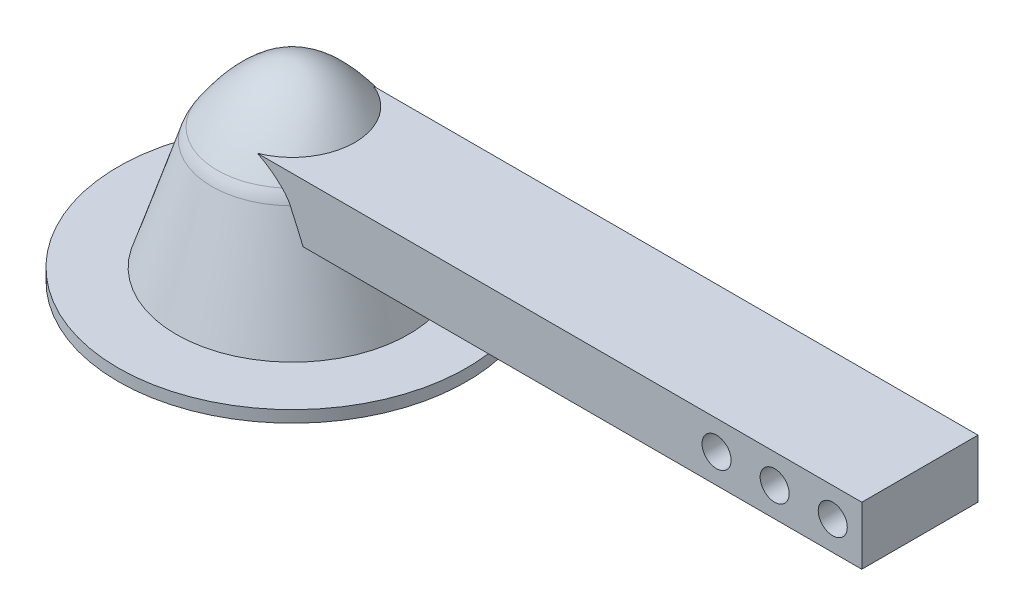
from build123d import *

# Parameters (mm, degrees)
SKETCH1_W                = 25.4
SKETCH1_H                = 6.35
FILLET1_R                = 10.16
BOSS_EXTRUDE1_DEPTH      = 38.1
BOSS_EXTRUDE1_DEPTH_BACK = 20.32
SKETCH3_W                = 25.4
SKETCH3_H                = 12.7
SKETCH4_W                = 25.4
SKETCH4_H                = 12.7
BOSS_EXTRUDE2_DEPTH      = 76.2
SKETCH5_R                = 3.175
CUT_EXTRUDE1_DEPTH       = 159.762008669


with BuildPart() as part:
    # Sketch1 → Revolve1 (revolve)
    with BuildSketch(Plane.XY, mode=Mode.PRIVATE) as revolve1_sk:
        Polygon((0, 48.048104246), (0, 22.664551268), (25.4, 22.664551268), (17.22966458, 48.048104246), align=None)
        Polygon((0, 22.664551268), (0, 20.09296726), (25.4, 20.09296726), (38.1, 20.09296726), (38.1, 22.664551268), (25.4, 22.664551268), align=None)
        with Locations((12.7, 16.91796726)):
            Rectangle(SKETCH1_W, SKETCH1_H)
    revolve(revolve1_sk.sketch.rotate(Axis((0, 27.702147105, 0), (0, -1, 0)), 90), axis=Axis((0, 27.702147105, 0), (0, -1, 0)))

    # Sketch2 → Revolve2 (revolve)
    with BuildSketch(Plane(origin=(0, 0, 0), x_dir=(0, 0, -1), z_dir=(1, 0, 0))):
        with BuildLine():
            Line((0, 48.048104246), (17.22966458, 48.048104246))
            add(Edge.make_bspline(
                [(17.22966458, 48.048104246), (8.61483229, 61.740341407), (0, 61.740341407)],
                knots=[0, 0, 0, 0.5, 0.5, 0.5], degree=2))
            Line((0, 61.740341407), (0, 48.048104246))
        make_face()
    revolve(axis=Axis((0, 0, 0), (0, 1, 0)))

    # Fillet1
    fillet1_edges = [part.edges().sort_by_distance(p)[0] for p in [
        (-17.22966458, 48.048104246, 0),
    ]]
    fillet(fillet1_edges, radius=FILLET1_R)

    # Sketch3 → Boss-Extrude1 (add, two sides: drawn at the far end of the back side and taken through both)
    with BuildSketch(Plane(origin=(22.86, 0, 0), x_dir=(0, 0, -1), z_dir=(1, 0, 0)).offset(-BOSS_EXTRUDE1_DEPTH_BACK)):
        with Locations((0, 46.783028789)):
            Rectangle(SKETCH3_W, SKETCH3_H)
    extrude(amount=BOSS_EXTRUDE1_DEPTH + BOSS_EXTRUDE1_DEPTH_BACK)

    # Sketch4 → Boss-Extrude2 (add)
    with BuildSketch(Plane(origin=(60.96, 0, 0), x_dir=(0, 0, -1), z_dir=(1, 0, 0))):
        with Locations((0, 46.783028789)):
            Rectangle(SKETCH4_W, SKETCH4_H)
    extrude(amount=BOSS_EXTRUDE2_DEPTH)

    # Sketch5 → Cut-Extrude1 (cut, through all)
    with BuildSketch(Plane(origin=(0, 0, -12.7), x_dir=(-1, 0, 0), z_dir=(0, 0, -1))):
        with Locations((-130.81, 46.783028789)):
            Circle(SKETCH5_R)
        with Locations((-118.11, 46.783028789)):
            Circle(SKETCH5_R)
        with Locations((-105.41, 46.783028789)):
            Circle(SKETCH5_R)
    extrude(amount=-CUT_EXTRUDE1_DEPTH, mode=Mode.SUBTRACT)


solid = part.part
